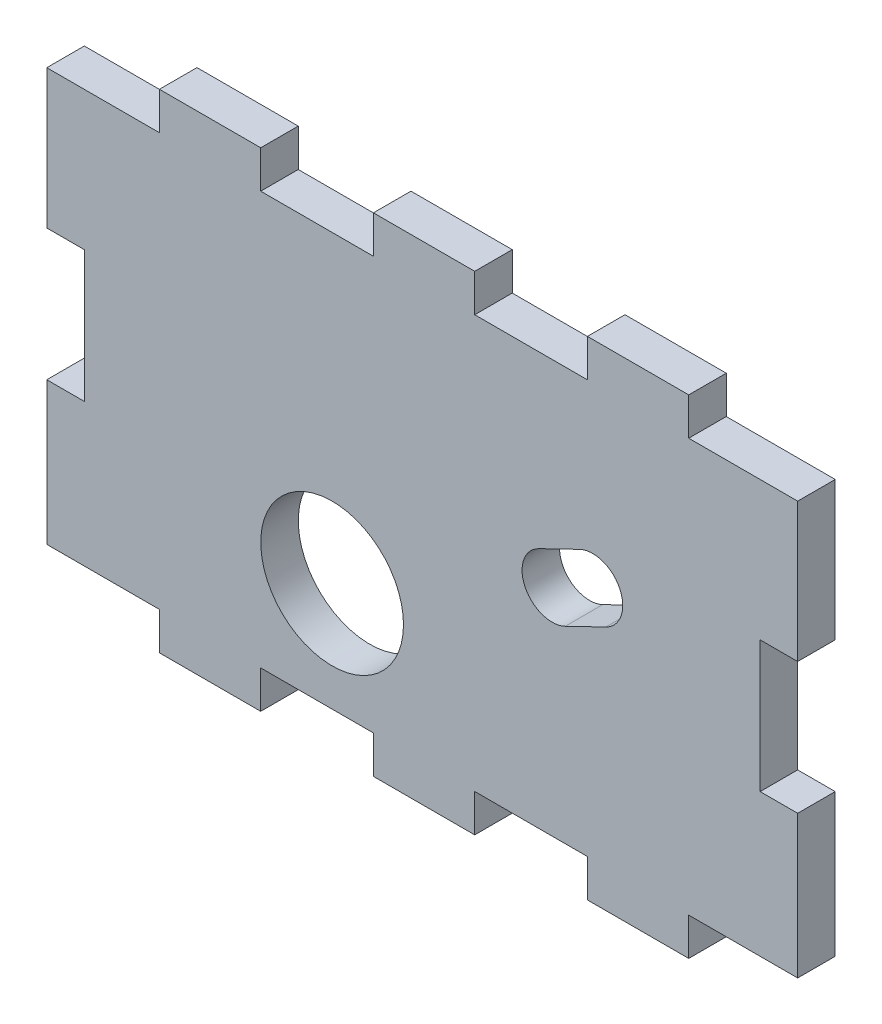
from build123d import *

# Parameters (mm, degrees)
ESQUISSE1_W             = 100
ESQUISSE1_H             = 65
BOSS_EXTRU_1_DEPTH      = 5
ESQUISSE2_W             = 15
ESQUISSE2_H             = 5.01
ESQUISSE2_W_2           = 15.01
ESQUISSE2_W_3           = 14.51
ESQUISSE2_W_4           = 5
ESQUISSE2_H_2           = 17.5
ENL_V_MAT_EXTRU_1_DEPTH = 5
ESQUISSE3_R             = 9.505
ENL_V_MAT_EXTRU_2_DEPTH = 10
ENL_V_MAT_EXTRU_3_DEPTH = 10


with BuildPart() as part:
    # Esquisse1 → Boss.-Extru.1 (new body)
    with BuildSketch(Plane.XY):
        Rectangle(ESQUISSE1_W, ESQUISSE1_H)
    extrude(amount=BOSS_EXTRU_1_DEPTH)

    # Esquisse2 → Enlèv. mat.-Extru.1 (cut)
    with BuildSketch(Plane.XY.offset(5)):
        with Locations((-42.5, 29.995)):
            Rectangle(ESQUISSE2_W, ESQUISSE2_H)
        with Locations((-14.005, 29.995)):
            Rectangle(ESQUISSE2_W_2, ESQUISSE2_H)
        with Locations((14.495, 29.995)):
            Rectangle(ESQUISSE2_W_2, ESQUISSE2_H)
        with Locations((42.745, 30.005)):
            Rectangle(ESQUISSE2_W_3, ESQUISSE2_H)
        with Locations((-47.5, 0.25)):
            Rectangle(ESQUISSE2_W_4, ESQUISSE2_H_2)
        with Locations((47.5, 0.25)):
            Rectangle(ESQUISSE2_W_4, ESQUISSE2_H_2)
        with Locations((42.745, -30.005)):
            Rectangle(ESQUISSE2_W_3, ESQUISSE2_H)
        with Locations((14.495, -29.995)):
            Rectangle(ESQUISSE2_W_2, ESQUISSE2_H)
        with Locations((-14.005, -29.995)):
            Rectangle(ESQUISSE2_W_2, ESQUISSE2_H)
        with Locations((-42.5, -29.995)):
            Rectangle(ESQUISSE2_W, ESQUISSE2_H)
    extrude(amount=-ENL_V_MAT_EXTRU_1_DEPTH, mode=Mode.SUBTRACT)

    # Esquisse3 → Enlèv. mat.-Extru.2 (cut)
    with BuildSketch(Plane.XY.offset(5)):
        with Locations((-12, -13)):
            Circle(ESQUISSE3_R)
    extrude(amount=-ENL_V_MAT_EXTRU_2_DEPTH, mode=Mode.SUBTRACT)

    # Esquisse4 → Enlèv. mat.-Extru.3 (cut)
    with BuildSketch(Plane.XY.offset(5)):
        with BuildLine():
            Line((24.445837429, 0.203360159), (19.045949486, -2.412210563))
            ThreePointArc((19.045949486, -2.412210563), (13.695630827, -0.553678818), (15.554162571, 4.796639841))
            Line((15.554162571, 4.796639841), (20.954050514, 7.412210563))
            ThreePointArc((20.954050514, 7.412210563), (26.304369173, 5.553678818), (24.445837429, 0.203360159))
        make_face()
    extrude(amount=-ENL_V_MAT_EXTRU_3_DEPTH, mode=Mode.SUBTRACT)


solid = part.part
